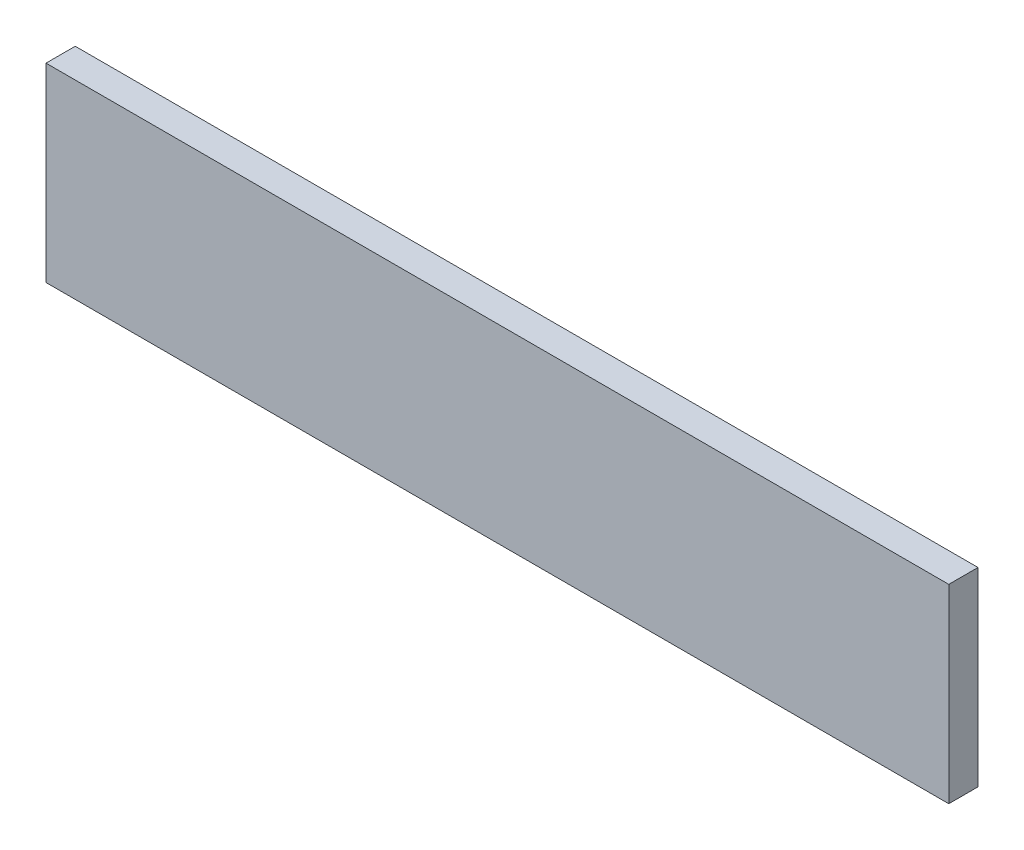
from build123d import *

# Parameters (mm, degrees)
ESQUISSE1_W        = 392.2161066
ESQUISSE1_H        = 82.55
BOSS_EXTRU_1_DEPTH = 12.7


with BuildPart() as part:
    # Esquisse1 → Boss.-Extru.1 (new body)
    with BuildSketch(Plane.XY):
        Rectangle(ESQUISSE1_W, ESQUISSE1_H)
    extrude(amount=BOSS_EXTRU_1_DEPTH)


solid = part.part
